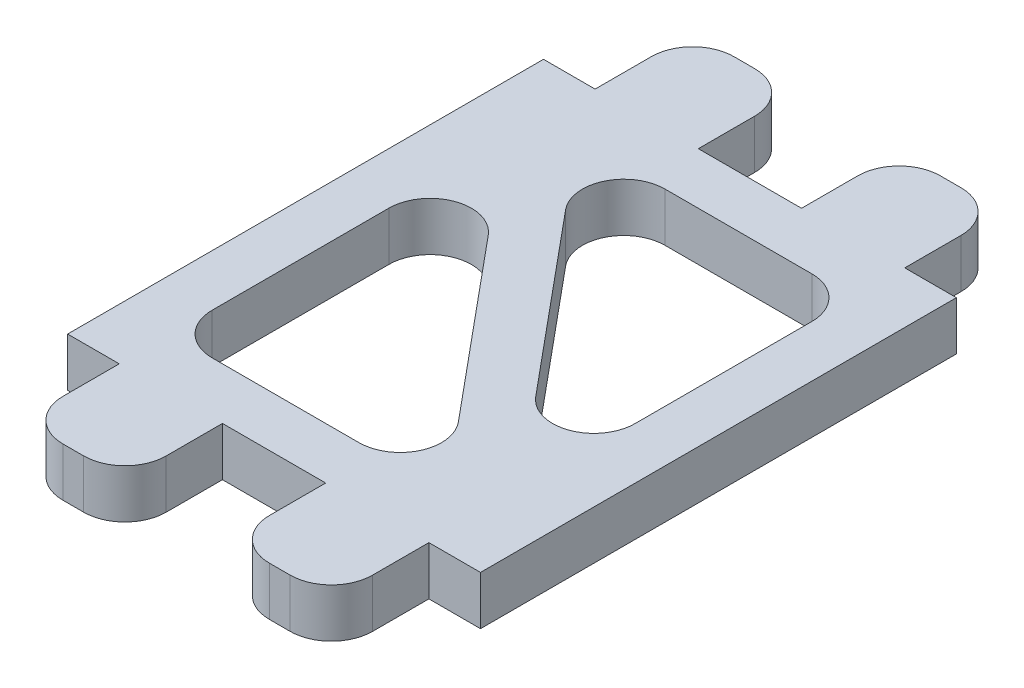
from build123d import *

# Parameters (mm, degrees)
SKETCH1_W               = 25.4
SKETCH1_H               = 29.275000124
BOSS_EXTRUDE1_DEPTH     = 3
SKETCH2_W               = 6.35
SKETCH2_H               = 3
BOSS_EXTRUDE2_DEPTH     = 6
LPATTERN1_COUNT         = 2
LPATTERN1_PITCH         = 12.7
MIRROR1_COPY_1_SKETCH_W = 6.35
MIRROR1_COPY_1_SKETCH_H = 3
MIRROR1_COPY_1_DEPTH    = 6
CUT_EXTRUDE1_DEPTH      = 25.417133509
CUT_EXTRUDE1_DEPTH_BACK = 25.417133509
FILLET1_R               = 2.54
FILLET2_R               = 2.54


with BuildPart() as part:
    # Sketch1 → Boss-Extrude1 (new body)
    with BuildSketch(Plane(origin=(0, 0, 0), x_dir=(1, 0, 0), z_dir=(0, 1, 0))):
        Rectangle(SKETCH1_W, SKETCH1_H)
    extrude(amount=BOSS_EXTRUDE1_DEPTH)

    # Sketch2 → Boss-Extrude2 (add)
    with BuildSketch(Plane.XY.offset(14.637500062)):
        with Locations((-6.35, 1.5)):
            Rectangle(SKETCH2_W, SKETCH2_H)
    boss_extrude2 = extrude(amount=BOSS_EXTRUDE2_DEPTH)

    # LPattern1: Boss-Extrude2 ×2
    with Locations(*[(i * LPATTERN1_PITCH, 0, 0) for i in range(1, LPATTERN1_COUNT)]):
        add(boss_extrude2)

    # Mirror1: Boss-Extrude2 across plane
    add(boss_extrude2.mirror(Plane.XY))

    # Mirror1 copy 1 sketch → Mirror1 copy 1 (add)
    with BuildSketch(Plane(origin=(12.7, 0, -14.637500062), x_dir=(1, 0, 0), z_dir=(0, 0, -1))):
        with Locations((-6.35, -1.5)):
            Rectangle(MIRROR1_COPY_1_SKETCH_W, MIRROR1_COPY_1_SKETCH_H)
    extrude(amount=MIRROR1_COPY_1_DEPTH)

    # Sketch4 → Cut-Extrude1 (cut, two sides: drawn at the far end of the back side and taken through both)
    with BuildSketch(Plane(origin=(0, 3, 0), x_dir=(1, 0, 0), z_dir=(0, 1, 0)).offset(-CUT_EXTRUDE1_DEPTH_BACK)):
        Polygon((7.460937373, -11.462500062), (-9.525, 8.978582163), (-9.525, -11.462500062), align=None)
        Polygon((9.525, 11.462500062), (-7.460937373, 11.462500062), (9.525, -8.978582163), align=None)
    extrude(amount=CUT_EXTRUDE1_DEPTH + CUT_EXTRUDE1_DEPTH_BACK, mode=Mode.SUBTRACT)

    # Fillet1
    fillet1_edges = [part.edges().sort_by_distance(p)[0] for p in [
        (-7.460937373, 1.5, -11.462500062),
        (9.525, 1.5, -11.462500062),
        (9.525, 1.5, 8.978582163),
        (-9.525, 1.5, -8.978582163),
        (7.460937373, 1.5, 11.462500062),
        (-9.525, 1.5, 11.462500062),
    ]]
    fillet(fillet1_edges, radius=FILLET1_R)

    # Fillet2
    fillet2_edges = [part.edges().sort_by_distance(p)[0] for p in [
        (-9.525, 1.5, 20.637500062),
        (-3.175, 1.5, 20.637500062),
        (3.175, 1.5, 20.637500062),
        (9.525, 1.5, 20.637500062),
        (-9.525, 1.5, -20.637500062),
        (-3.175, 1.5, -20.637500062),
        (3.175, 1.5, -20.637500062),
        (9.525, 1.5, -20.637500062),
    ]]
    fillet(fillet2_edges, radius=FILLET2_R)


solid = part.part
